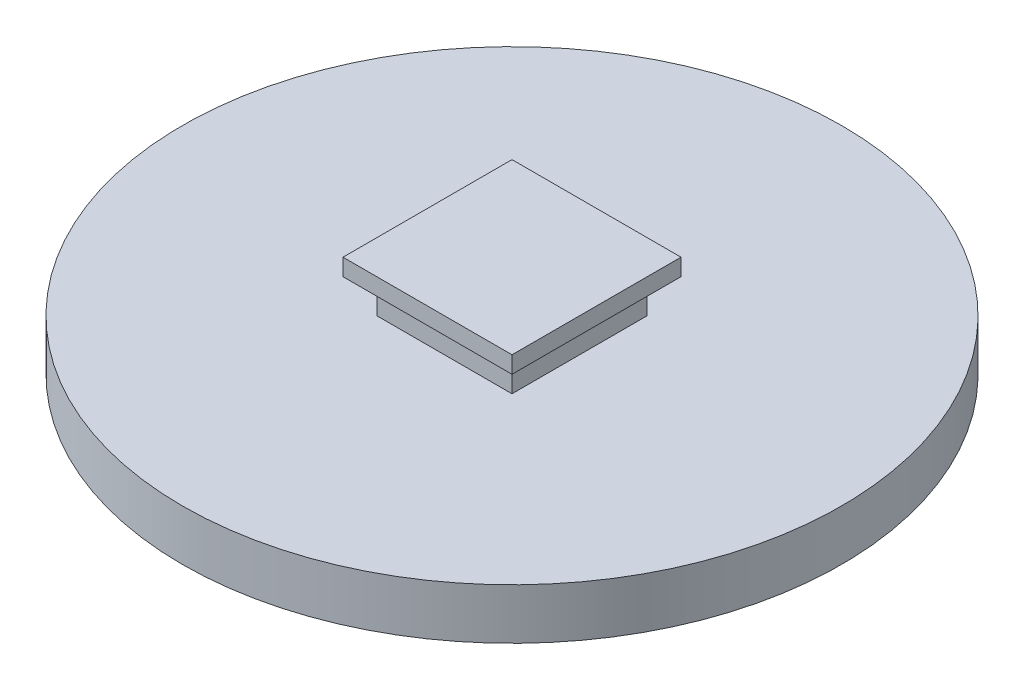
from build123d import *

# Parameters (mm, degrees)
SKETCH1_R           = 49.53
BOSS_EXTRUDE1_DEPTH = 7.62
SKETCH2_R           = 0.889
CUT_EXTRUDE1_DEPTH  = 2.54
CIRPATTERN1_COUNT   = 8
SKETCH4_W           = 5.0546
SKETCH4_H           = 50.546
BOSS_EXTRUDE3_DEPTH = 2.54
SKETCH5_W           = 20.32
SKETCH5_H           = 20.32
BOSS_EXTRUDE4_DEPTH = 5.08
SKETCH6_W           = 25.4
SKETCH6_H           = 25.4
BOSS_EXTRUDE5_DEPTH = 2.54


with BuildPart() as part:
    # Sketch1 → Boss-Extrude1 (new body)
    with BuildSketch(Plane(origin=(0, 0, 0), x_dir=(1, 0, 0), z_dir=(0, 1, 0))):
        with Locations(Location((0, 0, 0), (0, 0, 90))):
            Circle(SKETCH1_R)
    extrude(amount=BOSS_EXTRUDE1_DEPTH)

    # Sketch2 → Cut-Extrude1 (cut)
    with BuildSketch(Plane.XZ):
        with Locations(Location((-48.26, 0, 0), (0, 0, 270))):
            Circle(SKETCH2_R)
    cut_extrude1 = extrude(amount=-CUT_EXTRUDE1_DEPTH, mode=Mode.SUBTRACT)

    # CirPattern1: Cut-Extrude1 ×8 about axis
    cirpattern1_axis = Axis((0, 0, 0), (0, 1, 0))
    for i in range(1, CIRPATTERN1_COUNT):
        add(cut_extrude1.rotate(cirpattern1_axis, i * 360 / CIRPATTERN1_COUNT), mode=Mode.SUBTRACT)

    # Sketch4 → Boss-Extrude3 (add)
    with BuildSketch(Plane.XZ):
        Rectangle(SKETCH4_W, SKETCH4_H)
    extrude(amount=BOSS_EXTRUDE3_DEPTH)

    # Sketch5 → Boss-Extrude4 (add)
    with BuildSketch(Plane(origin=(0, 7.62, 0), x_dir=(1, 0, 0), z_dir=(0, 1, 0))):
        Rectangle(SKETCH5_W, SKETCH5_H)
    extrude(amount=BOSS_EXTRUDE4_DEPTH)

    # Sketch6 → Boss-Extrude5 (add)
    with BuildSketch(Plane(origin=(0, 12.7, 0), x_dir=(1, 0, 0), z_dir=(0, 1, 0))):
        Rectangle(SKETCH6_W, SKETCH6_H)
    extrude(amount=BOSS_EXTRUDE5_DEPTH)


solid = part.part
